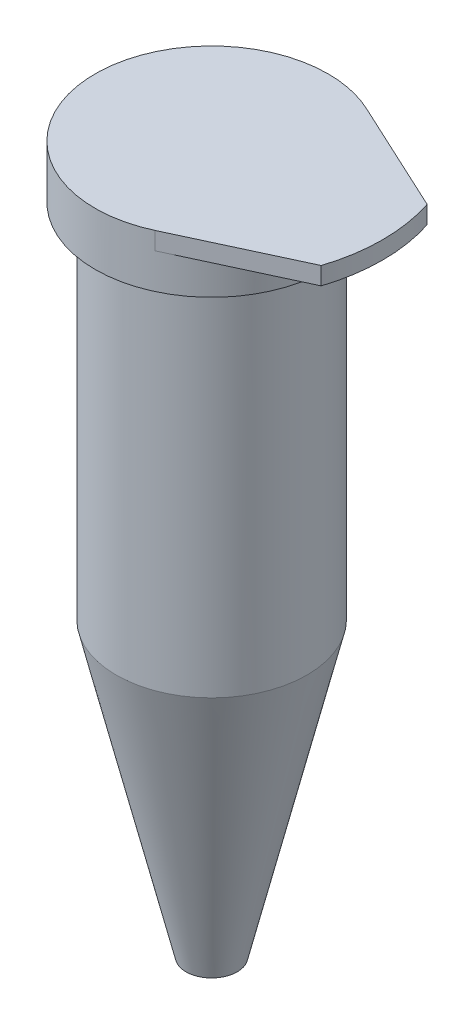
from build123d import *

# Parameters (mm, degrees)
SALIENTE_EXTRUIR1_DEPTH = 1


with BuildPart() as part:
    # Croquis1 → Revolución1 (revolve)
    with BuildSketch(Plane.XY, mode=Mode.PRIVATE) as revoluci_n1_sk:
        with BuildLine():
            Line((0, 40.5), (0, 0))
            ThreePointArc((0, 0), (0.762242399, 0.119036639), (1.451896979, 0.46481078))
            Line((1.451896979, 0.46481078), (5.4, 17))
            Line((5.4, 17), (5.4, 37.5))
            Line((5.4, 37.5), (6.6, 37.5))
            Line((6.6, 37.5), (6.6, 40.5))
            Line((6.6, 40.5), (0, 40.5))
        make_face()
    revolve(revoluci_n1_sk.sketch.rotate(Axis((0, 0, 0), (0, 1, 0)), 180), axis=Axis((0, 0, 0), (0, 1, 0)))

    # Croquis2 → Saliente-Extruir1 (add)
    with BuildSketch(Plane(origin=(0, 40.5, 0), x_dir=(1, 0, 0), z_dir=(0, 1, 0))):
        with BuildLine():
            Line((9.209038218, 3), (2.780130903, 5.985889421))
            ThreePointArc((2.780130903, 5.985889421), (6.6, 0), (2.780130903, -5.985889421))
            Line((2.780130903, -5.985889421), (9.209038218, -3))
            ThreePointArc((9.209038218, -3), (9.685369631, 0), (9.209038218, 3))
        make_face()
    extrude(amount=-SALIENTE_EXTRUIR1_DEPTH)


solid = part.part
